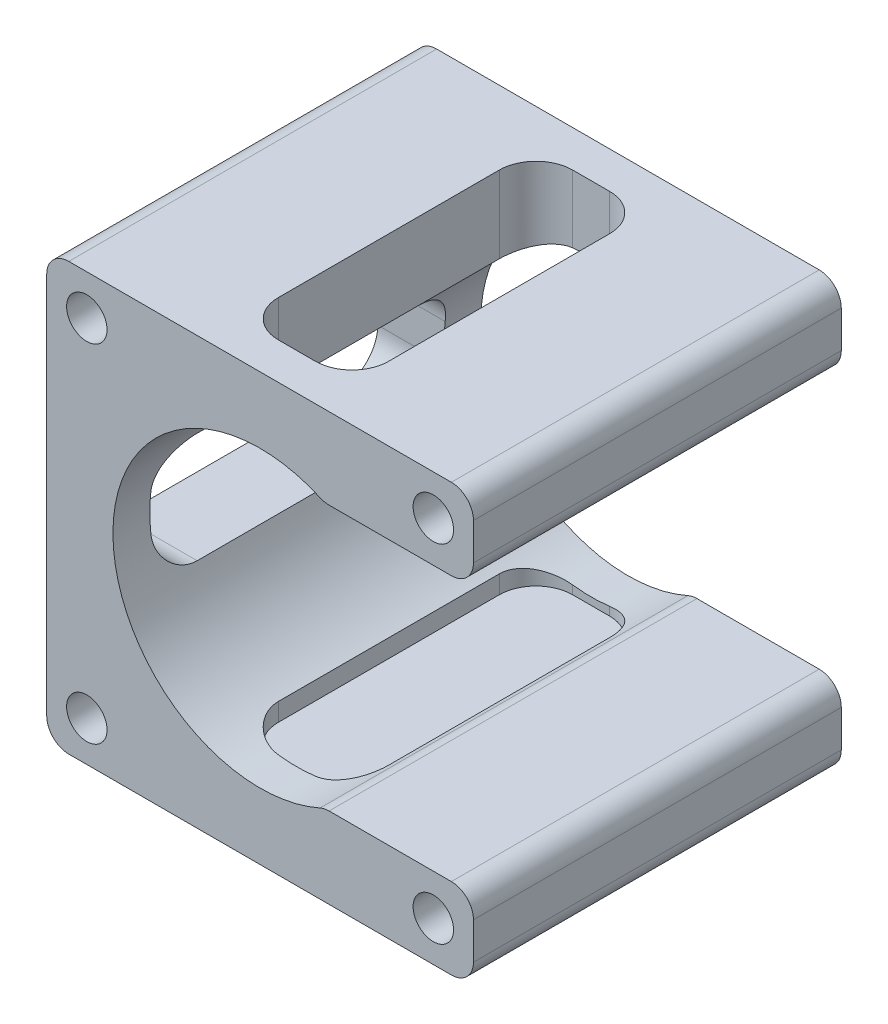
from build123d import *

# Parameters (mm, degrees)
SKETCH1_R           = 2.75
BOSS_EXTRUDE1_DEPTH = 50
CUT_EXTRUDE1_DEPTH  = 50
CUT_EXTRUDE2_DEPTH  = 50


with BuildPart() as part:
    # Sketch1 → Boss-Extrude1 (new body)
    with BuildSketch(Plane.XY):
        with BuildLine():
            Line((26, -29), (-26, -29))
            ThreePointArc((-26, -29), (-28.121320344, -28.121320344), (-29, -26))
            Line((-29, -26), (-29, 26))
            ThreePointArc((-29, 26), (-28.121320344, 28.121320344), (-26, 29))
            Line((-26, 29), (26, 29))
            ThreePointArc((26, 29), (28.121320344, 28.121320344), (29, 26))
            Line((29, 26), (29, 21))
            ThreePointArc((29, 21), (28.121320344, 18.878679656), (26, 18))
            Line((26, 18), (9.38083152, 18))
            ThreePointArc((9.38083152, 18), (8.755288277, 18.065942118), (8.1572448, 18.260869565))
            ThreePointArc((8.1572448, 18.260869565), (-20, 0), (8.1572448, -18.260869565))
            ThreePointArc((8.1572448, -18.260869565), (8.755288277, -18.065942118), (9.38083152, -18))
            Line((9.38083152, -18), (26, -18))
            ThreePointArc((26, -18), (28.121320344, -18.878679656), (29, -21))
            Line((29, -21), (29, -26))
            ThreePointArc((29, -26), (28.121320344, -28.121320344), (26, -29))
        make_face()
        with Locations((-23.55, 23.55)):
            Circle(SKETCH1_R, mode=Mode.SUBTRACT)
        with Locations((-23.55, -23.55)):
            Circle(SKETCH1_R, mode=Mode.SUBTRACT)
        with Locations((23.55, -23.55)):
            Circle(SKETCH1_R, mode=Mode.SUBTRACT)
        with Locations((23.55, 23.55)):
            Circle(SKETCH1_R, mode=Mode.SUBTRACT)
    extrude(amount=BOSS_EXTRUDE1_DEPTH)

    # Sketch2 → Cut-Extrude1 (cut)
    with BuildSketch(Plane(origin=(0, 29, 0), x_dir=(1, 0, 0), z_dir=(0, 1, 0))):
        with BuildLine():
            Line((-2.51, -45), (2.51, -45))
            ThreePointArc((2.51, -45), (6.038462838, -43.538462838), (7.5, -40.01))
            Line((7.5, -40.01), (7.5, -9.99))
            ThreePointArc((7.5, -9.99), (6.038462838, -6.461537162), (2.51, -5))
            Line((2.51, -5), (-2.51, -5))
            ThreePointArc((-2.51, -5), (-6.038462838, -6.461537162), (-7.5, -9.99))
            Line((-7.5, -9.99), (-7.5, -40.01))
            ThreePointArc((-7.5, -40.01), (-6.038462838, -43.538462838), (-2.51, -45))
        make_face()
    extrude(amount=-CUT_EXTRUDE1_DEPTH, mode=Mode.SUBTRACT)

    # Sketch3 → Cut-Extrude2 (cut)
    with BuildSketch(Plane.ZY.offset(29)):
        with BuildLine():
            Line((9.99, -7.5), (40.01, -7.5))
            ThreePointArc((40.01, -7.5), (43.538462838, -6.038462838), (45, -2.51))
            Line((45, -2.51), (45, 2.51))
            ThreePointArc((45, 2.51), (43.538462838, 6.038462838), (40.01, 7.5))
            Line((40.01, 7.5), (9.99, 7.5))
            ThreePointArc((9.99, 7.5), (6.461537162, 6.038462838), (5, 2.51))
            Line((5, 2.51), (5, -2.51))
            ThreePointArc((5, -2.51), (6.461537162, -6.038462838), (9.99, -7.5))
        make_face()
    extrude(amount=-CUT_EXTRUDE2_DEPTH, mode=Mode.SUBTRACT)


solid = part.part
